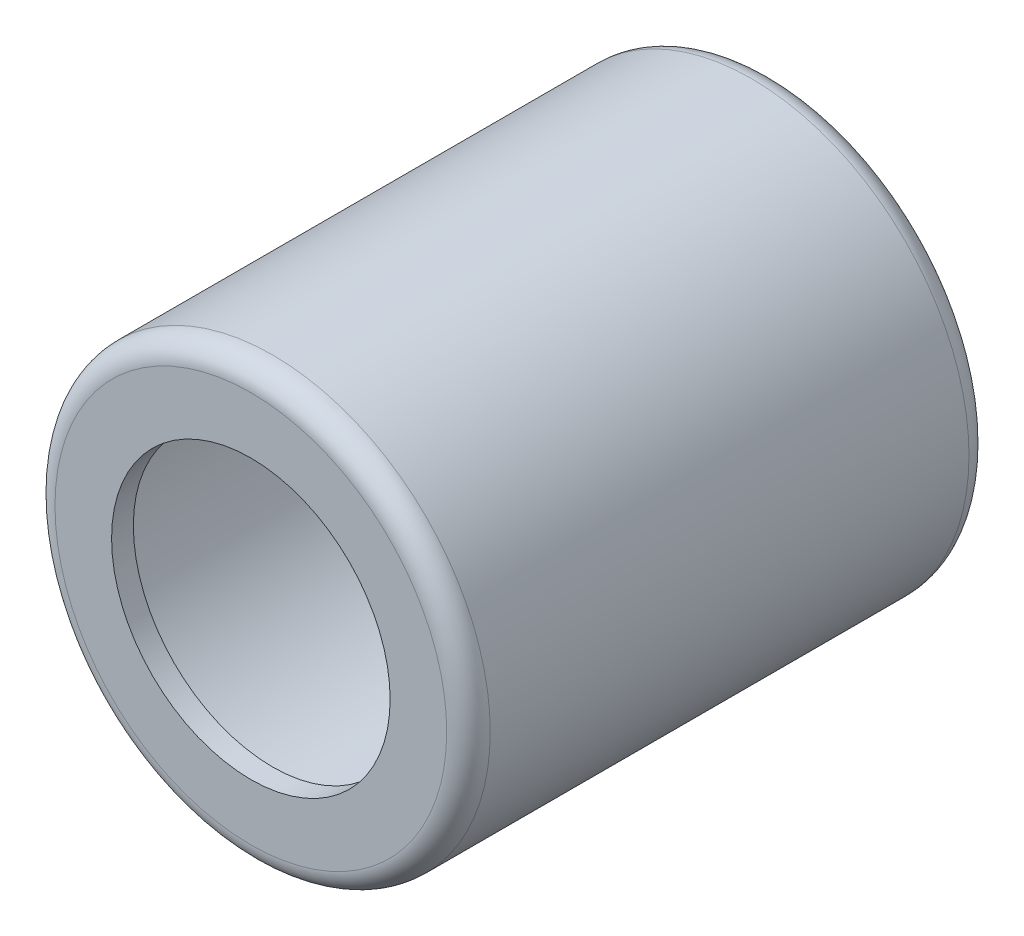
from build123d import *

# Parameters (mm, degrees)
FILLET_1_R = 0.3
FILLET_2_R = 0.5
FILLET_3_R = 0.5


with BuildPart() as part:
    # 草图1 → 旋转1 (revolve)
    with BuildSketch(Plane(origin=(0, 0, 0), x_dir=(1, 0, 0), z_dir=(0, 1, 0))):
        Polygon((3.2, -6), (5, -6), (5, 6), (3.2, 6), (3.2, 5.5), (4.5, 5.5), (4.5, -5.5), (3.2, -5.5), align=None)
    revolve(axis=Axis((0, 0, 32.403310218), (0, 0, -1)))

    # 圆角1
    fillet_1_edges = [part.edges().sort_by_distance(p)[0] for p in [
        (-4.5, 0, 5.5),
        (-4.5, 0, -5.5),
    ]]
    fillet(fillet_1_edges, radius=FILLET_1_R)

    # 圆角2
    fillet_2_edges = [part.edges().sort_by_distance(p)[0] for p in [
        (-5, 0, 6),
    ]]
    fillet(fillet_2_edges, radius=FILLET_2_R)

    # 圆角3
    fillet_3_edges = [part.edges().sort_by_distance(p)[0] for p in [
        (-5, 0, -6),
    ]]
    fillet(fillet_3_edges, radius=FILLET_3_R)


solid = part.part
